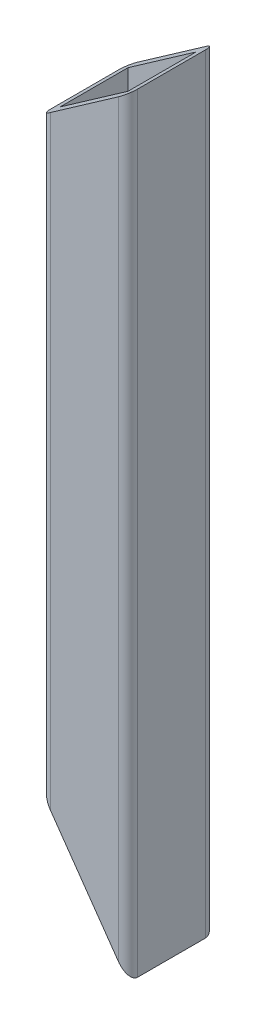
from build123d import *

# Parameters (mm, degrees)
BOSS_EXTRUDE1_DEPTH     = 226
SKETCH3_W               = 20
SKETCH3_H               = 20
CUT_EXTRUDE1_DEPTH      = 226
CUT_EXTRUDE2_DEPTH      = 229.881454032
CUT_EXTRUDE2_DEPTH_BACK = 229.881454032
CUT_EXTRUDE6_DEPTH      = 229.881454032
CUT_EXTRUDE6_DEPTH_BACK = 229.881454032


with BuildPart() as part:
    # Sketch1 → Boss-Extrude1 (new body)
    with BuildSketch(Plane(origin=(0, 0, 0), x_dir=(1, 0, 0), z_dir=(0, 1, 0))):
        with BuildLine():
            Line((2.8, 0), (22.8, 0))
            ThreePointArc((22.8, 0), (24.779898987, -0.820101013), (25.6, -2.8))
            Line((25.6, -2.8), (25.6, -22.8))
            ThreePointArc((25.6, -22.8), (24.779898987, -24.779898987), (22.8, -25.6))
            Line((22.8, -25.6), (2.8, -25.6))
            ThreePointArc((2.8, -25.6), (0.820101013, -24.779898987), (0, -22.8))
            Line((0, -22.8), (0, -2.8))
            ThreePointArc((0, -2.8), (0.820101013, -0.820101013), (2.8, 0))
        make_face()
    extrude(amount=BOSS_EXTRUDE1_DEPTH)

    # Sketch3 → Cut-Extrude1 (cut)
    with BuildSketch(Plane(origin=(0, 0, 0), x_dir=(-1, 0, 0), z_dir=(0, -1, 0))):
        with Locations((-12.8, -12.8)):
            Rectangle(SKETCH3_W, SKETCH3_H)
    extrude(amount=-CUT_EXTRUDE1_DEPTH, mode=Mode.SUBTRACT)

    # Sketch4 → Cut-Extrude2 (cut, two sides: drawn at the far end of the back side and taken through both)
    with BuildSketch(Plane.XY.offset(25.6).offset(-CUT_EXTRUDE2_DEPTH_BACK)):
        Polygon((292.650031695, -380.726252748), (25.794820766, 0), (0, 36.801850023), (-266.85521093, 417.528102771), (-1028.307716425, -116.182319088), (-468.802473801, -914.436674607), align=None)
    extrude(amount=CUT_EXTRUDE2_DEPTH + CUT_EXTRUDE2_DEPTH_BACK, mode=Mode.SUBTRACT)

    # Sketch5 → Cut-Extrude6 (cut, two sides: drawn at the far end of the back side and taken through both)
    with BuildSketch(Plane.XY.offset(25.6).offset(-CUT_EXTRUDE6_DEPTH_BACK)):
        Polygon((405.963593752, 492.333455606), (25.6, 226), (0, 208.074687022), (-380.363593752, -58.258768584), (-913.030504964, 702.468418921), (-126.70331746, 1253.060643111), align=None)
    extrude(amount=CUT_EXTRUDE6_DEPTH + CUT_EXTRUDE6_DEPTH_BACK, mode=Mode.SUBTRACT)


solid = part.part
